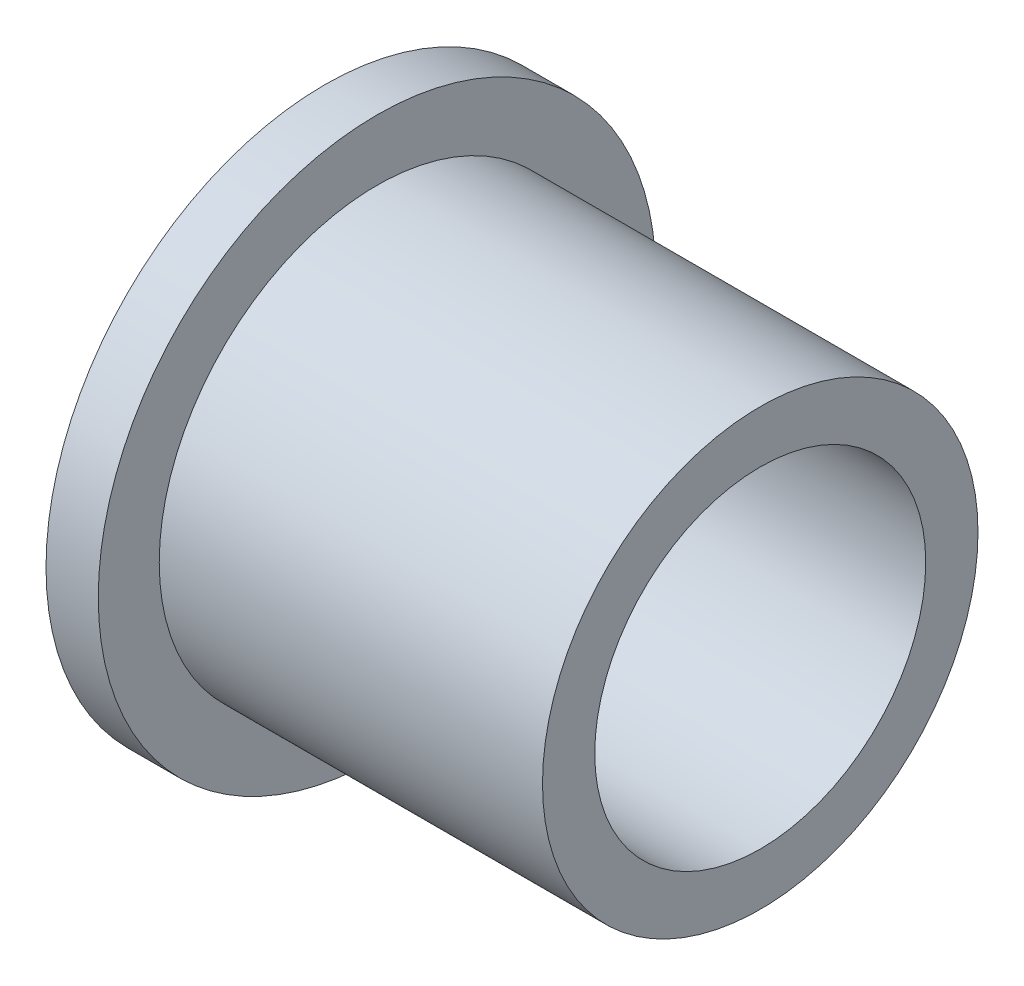
from build123d import *

# Parameters (mm, degrees)
SKETCH2_R          = 9.5
CUT_EXTRUDE1_DEPTH = 34.7194306


with BuildPart() as part:
    # Sketch1 → Revolve2 (revolve)
    with BuildSketch(Plane.XY, mode=Mode.PRIVATE) as revolve2_sk:
        Polygon((0, 0), (0, 16), (3, 16), (3, 12.5), (25, 12.5), (25, 0), align=None)
    revolve(revolve2_sk.sketch.rotate(Axis((-38.19047619, 0, 0), (1, 0, 0)), 90), axis=Axis((-38.19047619, 0, 0), (1, 0, 0)))

    # Sketch2 → Cut-Extrude1 (cut, through all)
    with BuildSketch(Plane(origin=(25, 0, 0), x_dir=(0, 0, -1), z_dir=(1, 0, 0))):
        Circle(SKETCH2_R)
    extrude(amount=-CUT_EXTRUDE1_DEPTH, mode=Mode.SUBTRACT)


solid = part.part
